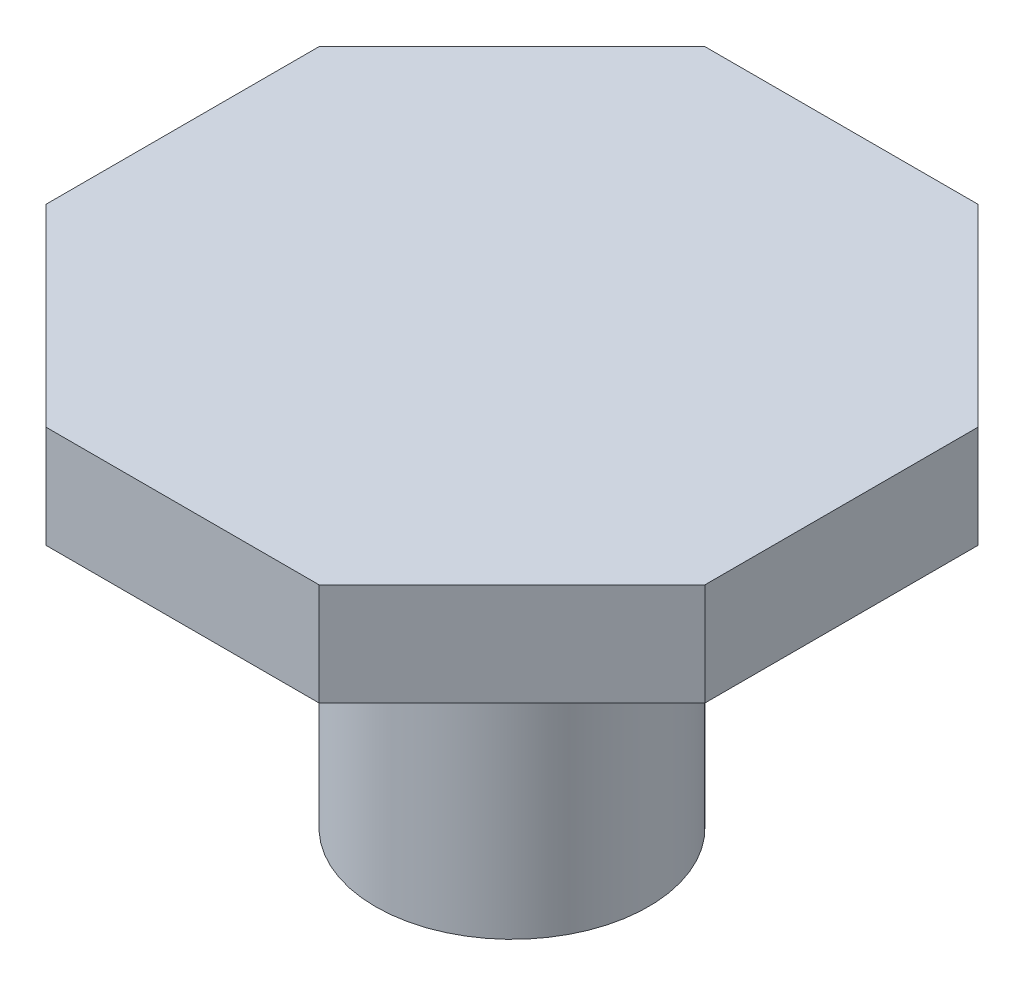
from build123d import *

# Parameters (mm, degrees)
SKETCH1_R           = 2
BOSS_EXTRUDE1_DEPTH = 5
BOSS_EXTRUDE2_DEPTH = 1.5


with BuildPart() as part:
    # Sketch1 → Boss-Extrude1 (new body)
    with BuildSketch(Plane(origin=(0, 0, 0), x_dir=(1, 0, 0), z_dir=(0, 1, 0))):
        with Locations(Location((0, 0, 0), (0, 0, 270))):
            Circle(SKETCH1_R)
    extrude(amount=BOSS_EXTRUDE1_DEPTH)

    # Sketch2 → Boss-Extrude2 (add)
    with BuildSketch(Plane(origin=(0, 5, 0), x_dir=(1, 0, 0), z_dir=(0, 1, 0))):
        Polygon((4.828427125, 2), (2, 4.828427125), (-2, 4.828427125), (-4.828427125, 2), (-4.828427125, -2), (-2, -4.828427125), (2, -4.828427125), (4.828427125, -2), align=None)
    extrude(amount=BOSS_EXTRUDE2_DEPTH)


solid = part.part
